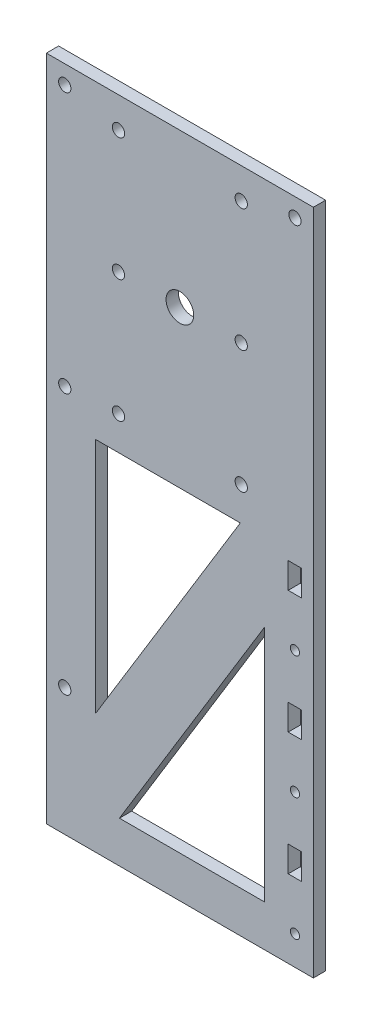
from build123d import *

# Parameters (mm, degrees)
SKETCH_1_R          = 2
SKETCH_1_R_2        = 4.5
EXTRUDE_1_DEPTH     = 4
SKETCH_2_R          = 1.5
SKETCH_2_W          = 4.4
SKETCH_2_H          = 8.4
CUT_EXTRUDE_1_DEPTH = 4
SKETCH_3_W          = 87
SKETCH_3_H          = 3.5
EXTRUDE_2_DEPTH     = 4


with BuildPart() as part:
    # 草图1 → 凸台-拉伸1 (new body)
    with BuildSketch(Plane.XY):
        Polygon((37.5, 50), (-37.5, 50), (-43.5, 50), (-43.5, -57), (-43.5, -164), (-37.5, -164), (37.5, -164), (43.5, -164), (43.5, -57), (43.5, 50), align=None)
        with Locations((-37.5, -126)):
            Circle(SKETCH_1_R, mode=Mode.SUBTRACT)
        Polygon((-27.5, -128.391668474), (-27.5, -51), (19.690041753, -51), align=None, mode=Mode.SUBTRACT)
        Polygon((-19.690041753, -154), (27.5, -76.608331526), (27.5, -154), align=None, mode=Mode.SUBTRACT)
        with Locations((-37.5, -41)):
            Circle(SKETCH_1_R, mode=Mode.SUBTRACT)
        with Locations((-20, -40)):
            Circle(SKETCH_1_R, mode=Mode.SUBTRACT)
        with Locations((-37.5, 44)):
            Circle(SKETCH_1_R, mode=Mode.SUBTRACT)
        with Locations((-20, 0)):
            Circle(SKETCH_1_R, mode=Mode.SUBTRACT)
        Circle(SKETCH_1_R_2, mode=Mode.SUBTRACT)
        with Locations((-20, 40)):
            Circle(SKETCH_1_R, mode=Mode.SUBTRACT)
        with Locations((20, -40)):
            Circle(SKETCH_1_R, mode=Mode.SUBTRACT)
        with Locations((20, 0)):
            Circle(SKETCH_1_R, mode=Mode.SUBTRACT)
        with Locations((20, 40)):
            Circle(SKETCH_1_R, mode=Mode.SUBTRACT)
        with Locations((37.5, 44)):
            Circle(SKETCH_1_R, mode=Mode.SUBTRACT)
    extrude(amount=EXTRUDE_1_DEPTH)

    # 草图2 → 切除-拉伸1 (cut)
    with BuildSketch(Plane.XY.offset(4)):
        with Locations((37.5, -158)):
            Circle(SKETCH_2_R)
        with Locations((37.5, -78)):
            Circle(SKETCH_2_R)
        with Locations((37.5, -118)):
            Circle(SKETCH_2_R)
        with Locations((37.5, -138)):
            Rectangle(SKETCH_2_W, SKETCH_2_H)
        with Locations((37.5, -98)):
            Rectangle(SKETCH_2_W, SKETCH_2_H)
        with Locations((37.5, -58)):
            Rectangle(SKETCH_2_W, SKETCH_2_H)
    extrude(amount=-CUT_EXTRUDE_1_DEPTH, mode=Mode.SUBTRACT)

    # 草图3 → 凸台-拉伸2 (add)
    with BuildSketch(Plane.XY.offset(4)):
        with Locations((0, -165.75)):
            Rectangle(SKETCH_3_W, SKETCH_3_H)
    extrude(amount=-EXTRUDE_2_DEPTH)


solid = part.part
